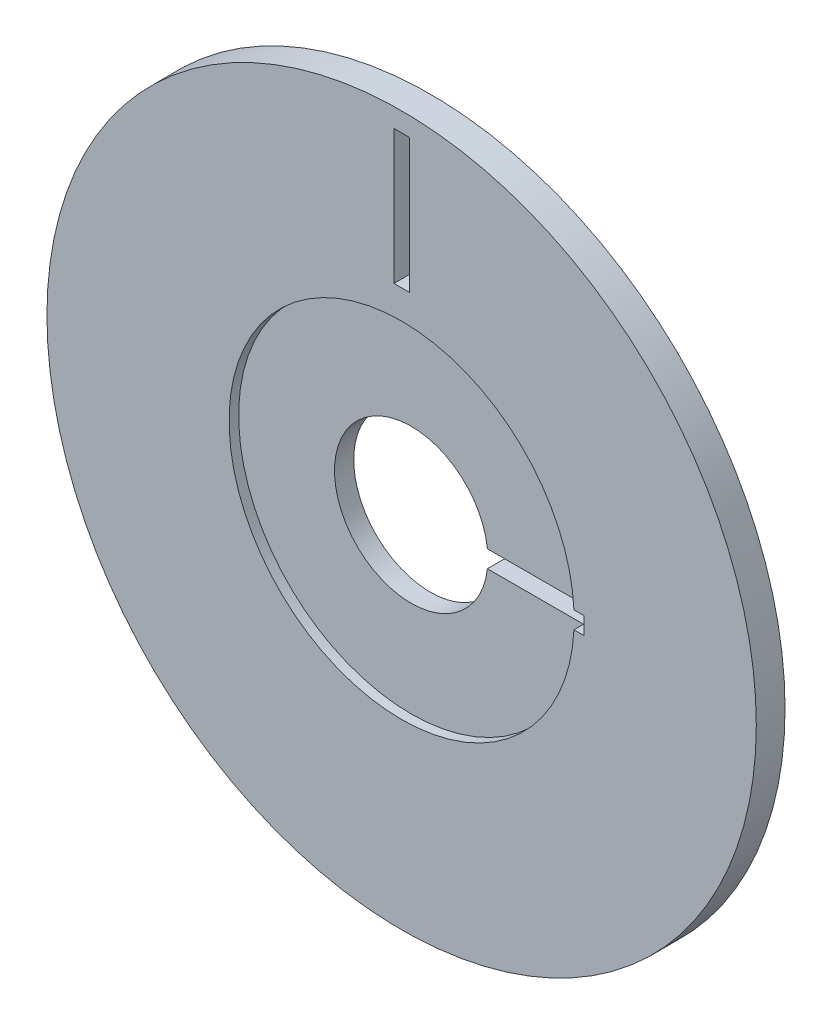
from build123d import *

# Parameters (mm, degrees)
SKETCH_1_R          = 18.5
EXTRUDE_1_DEPTH     = 1.5
SKETCH_2_R          = 4
CUT_EXTRUDE_1_DEPTH = 27.205915363
SKETCH_3_R          = 9
CUT_EXTRUDE_2_DEPTH = 0.5
SKETCH_4_W          = 7
SKETCH_4_H          = 0.9
CUT_EXTRUDE_3_DEPTH = 27.205915363
SKETCH_5_W          = 0.8
SKETCH_5_H          = 7
CUT_EXTRUDE_4_DEPTH = 27.205915363


with BuildPart() as part:
    # Эскиз1 → Бобышка-Вытянуть1 (new body)
    with BuildSketch(Plane.XY):
        Circle(SKETCH_1_R)
    extrude(amount=EXTRUDE_1_DEPTH)

    # Эскиз2 → Вырез-Вытянуть1 (cut, through all)
    with BuildSketch(Plane.XY.offset(1.5)):
        Circle(SKETCH_2_R)
    extrude(amount=-CUT_EXTRUDE_1_DEPTH, mode=Mode.SUBTRACT)

    # Эскиз3 → Вырез-Вытянуть2 (cut)
    with BuildSketch(Plane.XY.offset(1.5)):
        Circle(SKETCH_3_R)
    extrude(amount=-CUT_EXTRUDE_2_DEPTH, mode=Mode.SUBTRACT)

    # Эскиз4 → Вырез-Вытянуть3 (cut, through all)
    with BuildSketch(Plane.XY.offset(1.5)):
        with Locations((6.013449427, 0)):
            Rectangle(SKETCH_4_W, SKETCH_4_H)
    extrude(amount=-CUT_EXTRUDE_3_DEPTH, mode=Mode.SUBTRACT)

    # Эскиз5 → Вырез-Вытянуть4 (cut, through all)
    with BuildSketch(Plane.XY.offset(1.5)):
        with Locations((0, 14)):
            Rectangle(SKETCH_5_W, SKETCH_5_H)
    extrude(amount=-CUT_EXTRUDE_4_DEPTH, mode=Mode.SUBTRACT)


solid = part.part
